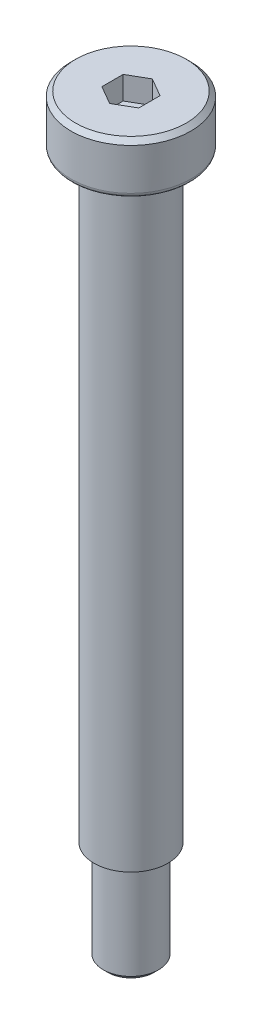
from build123d import *

# Parameters (mm, degrees)
CUT_EXTRUDE1_DEPTH = 2.5
CHAMFER1_SIZE      = 0.5
FILLET1_R          = 0.5
CHAMFER2_SIZE      = 0.5


with BuildPart() as part:
    # Sketch1 → Revolve1 (revolve)
    with BuildSketch(Plane.XY, mode=Mode.PRIVATE) as revolve1_sk:
        Polygon((0, 0), (6.5, 0), (6.5, -5.5), (3.75, -5.5), (3.75, -5.75), (4, -5.75), (4, -70.5), (3, -70.5), (3, -81.5), (0, -81.5), align=None)
    revolve(revolve1_sk.sketch.rotate(Axis((0, 5, 0), (0, -1, 0)), 180), axis=Axis((0, 5, 0), (0, -1, 0)))

    # Sketch2 → Cut-Extrude1 (cut)
    with BuildSketch(Plane(origin=(0, 0, 0), x_dir=(1, 0, 0), z_dir=(0, 1, 0))):
        Polygon((0, -2.309401077), (2, -1.154700538), (2, 1.154700538), (0, 2.309401077), (-2, 1.154700538), (-2, -1.154700538), align=None)
    extrude(amount=-CUT_EXTRUDE1_DEPTH, mode=Mode.SUBTRACT)

    # Chamfer1
    chamfer1_edges = [part.edges().sort_by_distance(p)[0] for p in [
        (6.5, 0, 0),
    ]]
    chamfer(chamfer1_edges, length=CHAMFER1_SIZE)

    # Fillet1
    fillet1_edges = [part.edges().sort_by_distance(p)[0] for p in [
        (6.5, -5.5, 0),
    ]]
    fillet(fillet1_edges, radius=FILLET1_R)

    # Chamfer2
    chamfer2_edges = [part.edges().sort_by_distance(p)[0] for p in [
        (3, -81.5, 0),
    ]]
    chamfer(chamfer2_edges, length=CHAMFER2_SIZE)


solid = part.part
